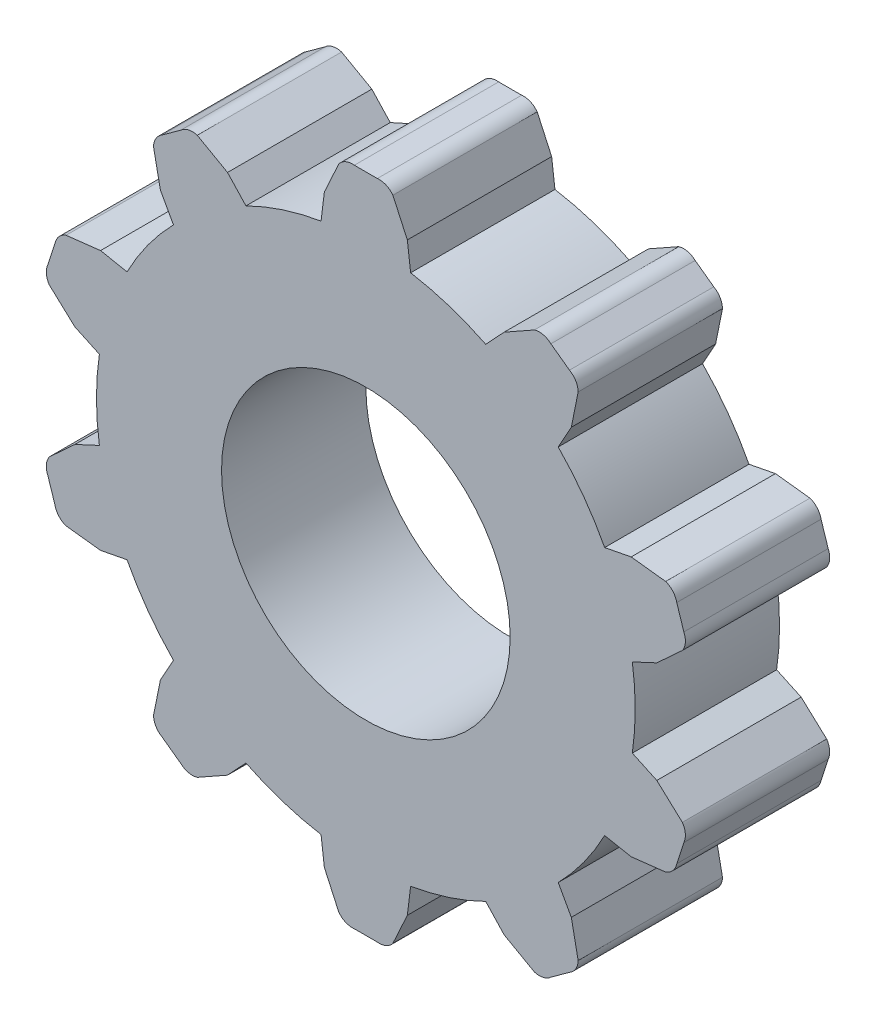
from build123d import *

# Parameters (mm, degrees)
SZKIC1_R                    = 30
DODANIE_WYCI_GNI_CIE1_DEPTH = 30


with BuildPart() as part:
    # Szkic1 → Dodanie-wyciągnięcie1 (new body)
    with BuildSketch(Plane.XY):
        with BuildLine():
            Line((-48.200266446, 55.220649807), (-47.516798881, 60.795035566))
            Line((-47.516798881, 60.795035566), (-44.510409747, 67.354430039))
            ThreePointArc((-44.510409747, 67.354430039), (-43.078000693, 68.471781184), (-41.280473034, 68.734770905))
            Line((-41.280473034, 68.734770905), (-36.499658689, 68.734770905))
            ThreePointArc((-36.499658689, 68.734770905), (-34.70213103, 68.471781184), (-33.269721976, 67.354430039))
            Line((-33.269721976, 67.354430039), (-30.263332842, 60.795035566))
            Line((-30.263332842, 60.795035566), (-29.579865278, 55.220649807))
            ThreePointArc((-29.579865278, 55.220649807), (-21.585114177, 53.259164913), (-13.964292777, 50.146842733))
            Line((-13.964292777, 50.146842733), (-10.134814162, 54.254883391))
            Line((-10.134814162, 54.254883391), (-3.847078926, 57.794433797))
            ThreePointArc((-3.847078926, 57.794433797), (-2.031473134, 57.856440945), (-0.42266123, 57.01264385))
            Line((-0.42266123, 57.01264385), (3.445098822, 54.202551684))
            ThreePointArc((3.445098822, 54.202551684), (4.744747767, 52.933228281), (5.24682851, 51.187323299))
            Line((5.24682851, 51.187323299), (3.823533075, 44.113550502))
            Line((3.823533075, 44.113550502), (1.09992821, 39.202045535))
            ThreePointArc((1.09992821, 39.202045535), (6.414885823, 32.915974128), (10.75088277, 25.918646164))
            Line((10.75088277, 25.918646164), (16.263641763, 26.991209816))
            Line((16.263641763, 26.991209816), (23.431021953, 26.158928205))
            ThreePointArc((23.431021953, 26.158928205), (24.936324781, 25.141906732), (25.741909464, 23.513624632))
            Line((25.741909464, 23.513624632), (27.219262344, 18.966799996))
            ThreePointArc((27.219262344, 18.966799996), (27.52461085, 17.17598131), (26.904585503, 15.468398852))
            Line((26.904585503, 15.468398852), (21.595255981, 10.582188511))
            Line((21.595255981, 10.582188511), (16.504903173, 8.209592297))
            ThreePointArc((16.504903173, 8.209592297), (17.109934138, 0), (16.504903173, -8.209592297))
            Line((16.504903173, -8.209592297), (21.595255981, -10.582188511))
            Line((21.595255981, -10.582188511), (26.904585503, -15.468398852))
            ThreePointArc((26.904585503, -15.468398852), (27.52461085, -17.17598131), (27.219262344, -18.966799996))
            Line((27.219262344, -18.966799996), (25.741909464, -23.513624632))
            ThreePointArc((25.741909464, -23.513624632), (24.936324781, -25.141906732), (23.431021953, -26.158928205))
            Line((23.431021953, -26.158928205), (16.263641763, -26.991209816))
            Line((16.263641763, -26.991209816), (10.75088277, -25.918646164))
            ThreePointArc((10.75088277, -25.918646164), (6.414885823, -32.915974128), (1.09992821, -39.202045535))
            Line((1.09992821, -39.202045535), (3.823533075, -44.113550502))
            Line((3.823533075, -44.113550502), (5.24682851, -51.187323299))
            ThreePointArc((5.24682851, -51.187323299), (4.744747767, -52.933228281), (3.445098822, -54.202551684))
            Line((3.445098822, -54.202551684), (-0.42266123, -57.01264385))
            ThreePointArc((-0.42266123, -57.01264385), (-2.031473134, -57.856440945), (-3.847078926, -57.794433797))
            Line((-3.847078926, -57.794433797), (-10.134814162, -54.254883391))
            Line((-10.134814162, -54.254883391), (-13.964292777, -50.146842733))
            ThreePointArc((-13.964292777, -50.146842733), (-21.585114177, -53.259164913), (-29.579865278, -55.220649807))
            Line((-29.579865278, -55.220649807), (-30.263332842, -60.795035566))
            Line((-30.263332842, -60.795035566), (-33.269721976, -67.354430039))
            ThreePointArc((-33.269721976, -67.354430039), (-34.70213103, -68.471781184), (-36.499658689, -68.734770905))
            Line((-36.499658689, -68.734770905), (-41.280473034, -68.734770905))
            ThreePointArc((-41.280473034, -68.734770905), (-43.078000693, -68.471781184), (-44.510409747, -67.354430039))
            Line((-44.510409747, -67.354430039), (-47.516798881, -60.795035566))
            Line((-47.516798881, -60.795035566), (-48.200266446, -55.220649807))
            ThreePointArc((-48.200266446, -55.220649807), (-56.195017547, -53.259164913), (-63.815838947, -50.146842733))
            Line((-63.815838947, -50.146842733), (-67.645317562, -54.254883391))
            Line((-67.645317562, -54.254883391), (-73.933052797, -57.794433797))
            ThreePointArc((-73.933052797, -57.794433797), (-75.74865859, -57.856440945), (-77.357470494, -57.01264385))
            Line((-77.357470494, -57.01264385), (-81.225230545, -54.202551684))
            ThreePointArc((-81.225230545, -54.202551684), (-82.52487949, -52.933228281), (-83.026960233, -51.187323299))
            Line((-83.026960233, -51.187323299), (-81.603664799, -44.113550502))
            Line((-81.603664799, -44.113550502), (-78.880059934, -39.202045535))
            ThreePointArc((-78.880059934, -39.202045535), (-84.195017547, -32.915974128), (-88.531014493, -25.918646164))
            Line((-88.531014493, -25.918646164), (-94.043773486, -26.991209816))
            Line((-94.043773486, -26.991209816), (-101.211153677, -26.158928205))
            ThreePointArc((-101.211153677, -26.158928205), (-102.716456505, -25.141906732), (-103.522041188, -23.513624632))
            Line((-103.522041188, -23.513624632), (-104.999394067, -18.966799996))
            ThreePointArc((-104.999394067, -18.966799996), (-105.304742573, -17.17598131), (-104.684717227, -15.468398852))
            Line((-104.684717227, -15.468398852), (-99.375387704, -10.582188511))
            Line((-99.375387704, -10.582188511), (-94.285034896, -8.209592297))
            ThreePointArc((-94.285034896, -8.209592297), (-94.890065862, 0), (-94.285034896, 8.209592297))
            Line((-94.285034896, 8.209592297), (-99.375387704, 10.582188511))
            Line((-99.375387704, 10.582188511), (-104.684717227, 15.468398852))
            ThreePointArc((-104.684717227, 15.468398852), (-105.304742573, 17.17598131), (-104.999394067, 18.966799996))
            Line((-104.999394067, 18.966799996), (-103.522041188, 23.513624632))
            ThreePointArc((-103.522041188, 23.513624632), (-102.716456505, 25.141906732), (-101.211153677, 26.158928205))
            Line((-101.211153677, 26.158928205), (-94.043773486, 26.991209816))
            Line((-94.043773486, 26.991209816), (-88.531014493, 25.918646164))
            ThreePointArc((-88.531014493, 25.918646164), (-84.195017547, 32.915974128), (-78.880059934, 39.202045535))
            Line((-78.880059934, 39.202045535), (-81.603664799, 44.113550502))
            Line((-81.603664799, 44.113550502), (-83.026960233, 51.187323299))
            ThreePointArc((-83.026960233, 51.187323299), (-82.52487949, 52.933228281), (-81.225230545, 54.202551684))
            Line((-81.225230545, 54.202551684), (-77.357470494, 57.01264385))
            ThreePointArc((-77.357470494, 57.01264385), (-75.74865859, 57.856440945), (-73.933052797, 57.794433797))
            Line((-73.933052797, 57.794433797), (-67.645317562, 54.254883391))
            Line((-67.645317562, 54.254883391), (-63.815838947, 50.146842733))
            ThreePointArc((-63.815838947, 50.146842733), (-56.195017547, 53.259164913), (-48.200266446, 55.220649807))
        make_face()
        with Locations((-38.890065862, 0)):
            Circle(SZKIC1_R, mode=Mode.SUBTRACT)
    extrude(amount=DODANIE_WYCI_GNI_CIE1_DEPTH)


solid = part.part
